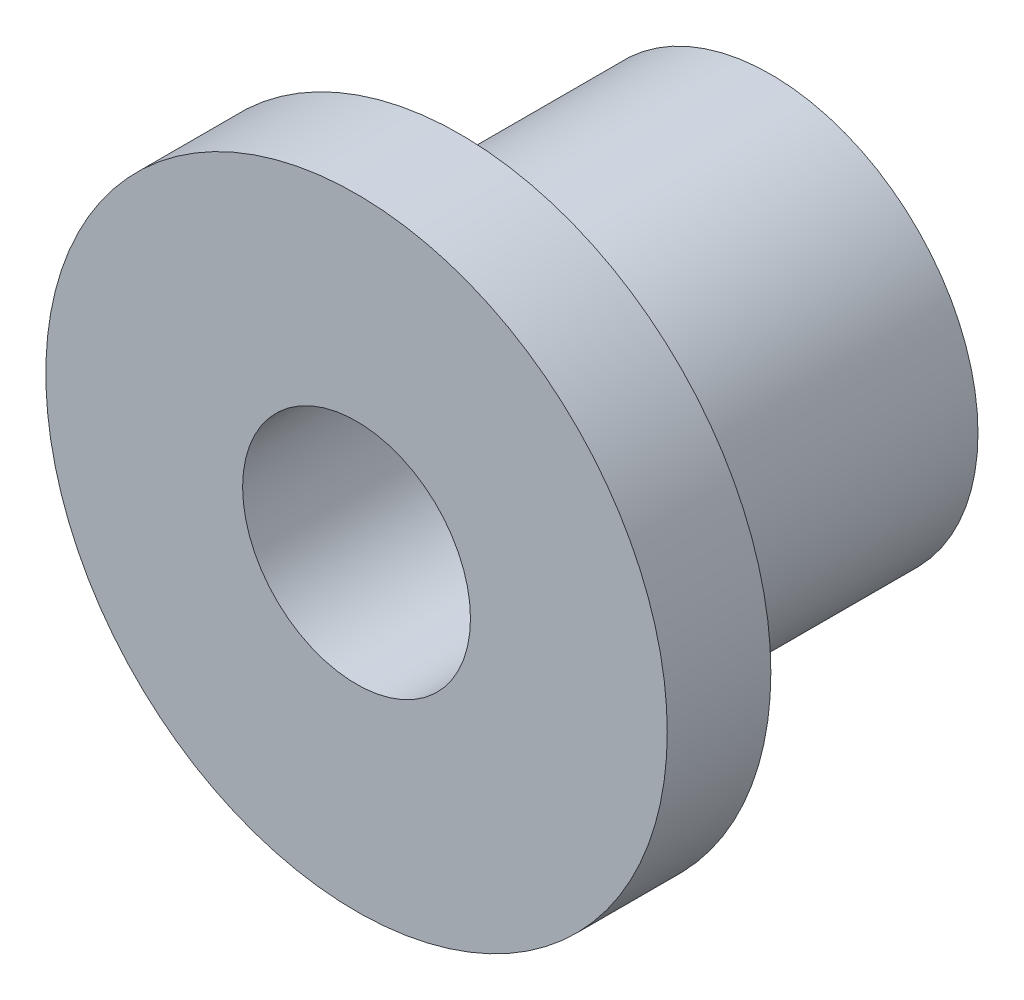
from build123d import *

# Parameters (mm, degrees)
FILLET1_R = 0.1


with BuildPart() as part:
    # Sketch1 → Revolve1 (revolve)
    with BuildSketch(Plane(origin=(0, 0, 0), x_dir=(1, 0, 0), z_dir=(0, 1, 0))):
        Polygon((1.65, 0), (1.65, 6), (3, 6), (3, 1.5), (4.5, 1.5), (4.5, 0), align=None)
    revolve(axis=Axis((0, 0, 0), (0, 0, -1)))

    # Fillet1
    fillet1_edges = [part.edges().sort_by_distance(p)[0] for p in [
        (-3, 0, -1.5),
    ]]
    fillet(fillet1_edges, radius=FILLET1_R)


solid = part.part
